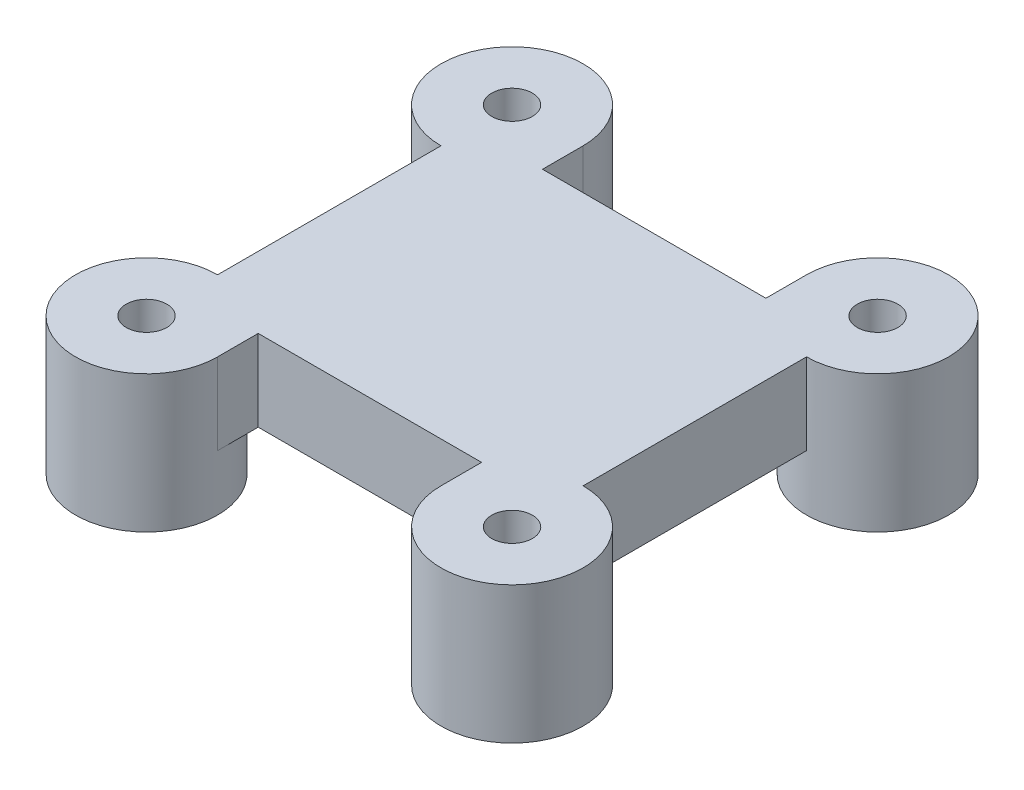
from build123d import *

# Parameters (mm, degrees)
SKETCH1_W           = 22
SKETCH1_H           = 28
BOSS_EXTRUDE1_DEPTH = 8
SKETCH2_R           = 2
CUT_EXTRUDE1_DEPTH  = 37.249137921
SKETCH5_R           = 7
SKETCH5_R_2         = 2
BOSS_EXTRUDE3_DEPTH = 5.5


with BuildPart() as part:
    # Sketch1 → Boss-Extrude1 (new body)
    with BuildSketch(Plane(origin=(0, 0, 0), x_dir=(1, 0, 0), z_dir=(0, 1, 0))):
        with BuildLine():
            ThreePointArc((-18, 11), (-13.050252532, 13.050252532), (-11, 18))
            Line((-11, 18), (-18, 18))
            Line((-18, 18), (-18, 11))
        make_face()
        with BuildLine():
            Line((-18, 18), (-11, 18))
            ThreePointArc((-11, 18), (-22.949747468, 22.949747468), (-18, 11))
            Line((-18, 11), (-18, 18))
        make_face()
        with BuildLine():
            Line((-11, -18), (-11, -14))
            Line((-11, -14), (-11, 14))
            Line((-11, 14), (-11, 18))
            ThreePointArc((-11, 18), (-13.050252532, 13.050252532), (-18, 11))
            Line((-18, 11), (-18, -11))
            ThreePointArc((-18, -11), (-13.050252532, -13.050252532), (-11, -18))
        make_face()
        with BuildLine():
            ThreePointArc((-18, -11), (-22.949747468, -22.949747468), (-11, -18))
            Line((-11, -18), (-18, -18))
            Line((-18, -18), (-18, -11))
        make_face()
        with BuildLine():
            Line((-18, -18), (-11, -18))
            ThreePointArc((-11, -18), (-13.050252532, -13.050252532), (-18, -11))
            Line((-18, -11), (-18, -18))
        make_face()
        Rectangle(SKETCH1_W, SKETCH1_H)
        with BuildLine():
            ThreePointArc((18, -11), (13.050252532, -13.050252532), (11, -18))
            Line((11, -18), (18, -18))
            Line((18, -18), (18, -11))
        make_face()
        with BuildLine():
            Line((18, -18), (11, -18))
            ThreePointArc((11, -18), (18, -25), (25, -18))
            ThreePointArc((25, -18), (22.949747468, -13.050252532), (18, -11))
            Line((18, -11), (18, -18))
        make_face()
        with BuildLine():
            Line((11, 14), (11, -14))
            Line((11, -14), (11, -18))
            ThreePointArc((11, -18), (13.050252532, -13.050252532), (18, -11))
            Line((18, -11), (18, 11))
            ThreePointArc((18, 11), (13.050252532, 13.050252532), (11, 18))
            Line((11, 18), (11, 14))
        make_face()
        with BuildLine():
            ThreePointArc((25, 18), (18, 25), (11, 18))
            Line((11, 18), (18, 18))
            Line((18, 18), (18, 11))
            ThreePointArc((18, 11), (22.949747468, 13.050252532), (25, 18))
        make_face()
        with BuildLine():
            Line((18, 18), (11, 18))
            ThreePointArc((11, 18), (13.050252532, 13.050252532), (18, 11))
            Line((18, 11), (18, 18))
        make_face()
    extrude(amount=BOSS_EXTRUDE1_DEPTH)

    # Sketch2 → Cut-Extrude1 (cut, through all)
    with BuildSketch(Plane(origin=(0, 8, 0), x_dir=(1, 0, 0), z_dir=(0, 1, 0))):
        with Locations(Location((-18, 18, 0), (0, 0, 270))):
            Circle(SKETCH2_R)
        with Locations(Location((-18, -18, 0), (0, 0, 270))):
            Circle(SKETCH2_R)
        with Locations(Location((18, -18, 0), (0, 0, 270))):
            Circle(SKETCH2_R)
        with Locations(Location((18, 18, 0), (0, 0, 270))):
            Circle(SKETCH2_R)
    extrude(amount=-CUT_EXTRUDE1_DEPTH, mode=Mode.SUBTRACT)

    # Sketch5 → Boss-Extrude3 (add)
    # profile 1 of 4: a face of its own
    with BuildSketch(Plane.XZ):
        with Locations(Location((-18, 18, 0), (0, 0, 270))):
            Circle(SKETCH5_R)
        with Locations(Location((-18, 18, 0), (0, 0, 90))):
            Circle(SKETCH5_R_2, mode=Mode.SUBTRACT)
    # profile 2 of 4: a face of its own
    with BuildSketch(Plane.XZ):
        with Locations(Location((18, 18, 0), (0, 0, 270))):
            Circle(SKETCH5_R)
        with Locations(Location((18, 18, 0), (0, 0, 90))):
            Circle(SKETCH5_R_2, mode=Mode.SUBTRACT)
    # profile 3 of 4: a face of its own
    with BuildSketch(Plane.XZ):
        with Locations(Location((18, -18, 0), (0, 0, 270))):
            Circle(SKETCH5_R)
        with Locations(Location((18, -18, 0), (0, 0, 90))):
            Circle(SKETCH5_R_2, mode=Mode.SUBTRACT)
    # profile 4 of 4: a face of its own
    with BuildSketch(Plane.XZ):
        with Locations(Location((-18, -18, 0), (0, 0, 270))):
            Circle(SKETCH5_R)
        with Locations(Location((-18, -18, 0), (0, 0, 90))):
            Circle(SKETCH5_R_2, mode=Mode.SUBTRACT)
    extrude(amount=BOSS_EXTRUDE3_DEPTH)


solid = part.part
